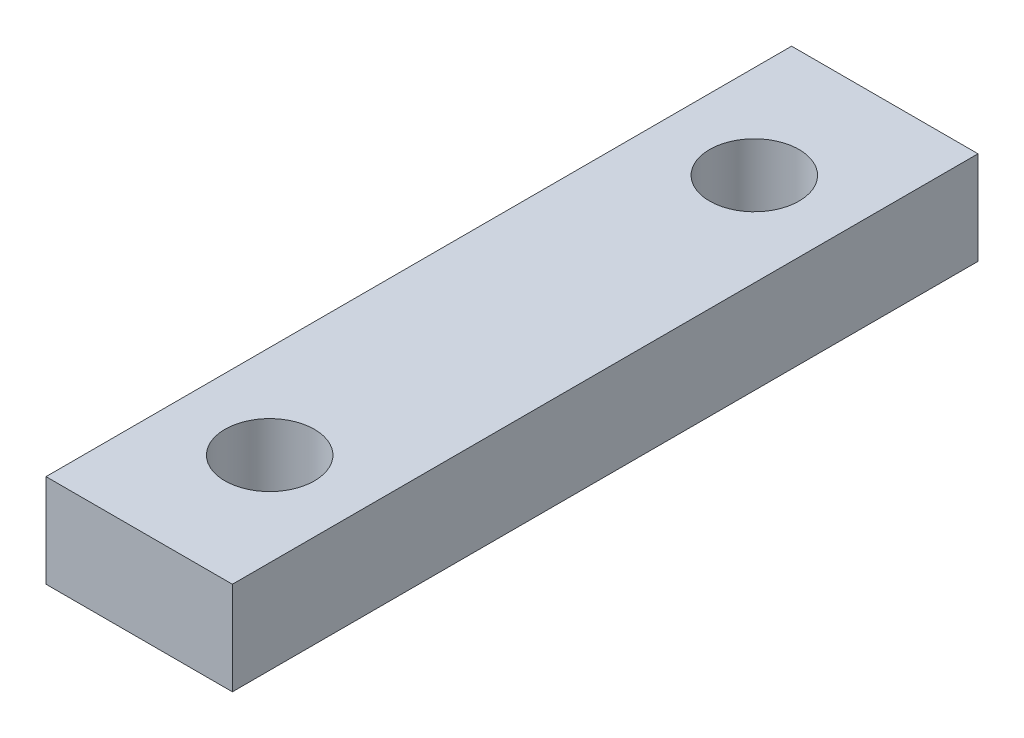
from build123d import *

# Parameters (mm, degrees)
SKETCH1_W           = 10
SKETCH1_H           = 40
SKETCH1_R           = 2.4
BOSS_EXTRUDE1_DEPTH = 5


with BuildPart() as part:
    # Sketch1 → Boss-Extrude1 (new body)
    with BuildSketch(Plane(origin=(0, 0, 0), x_dir=(1, 0, 0), z_dir=(0, 1, 0))):
        with Locations((0, 0.047470576)):
            Rectangle(SKETCH1_W, SKETCH1_H)
        with Locations(Location((0, 13.047470576, 0), (0, 0, 270))):
            Circle(SKETCH1_R, mode=Mode.SUBTRACT)
        with Locations(Location((0, -12.952529424, 0), (0, 0, 90))):
            Circle(SKETCH1_R, mode=Mode.SUBTRACT)
    extrude(amount=BOSS_EXTRUDE1_DEPTH)


solid = part.part
